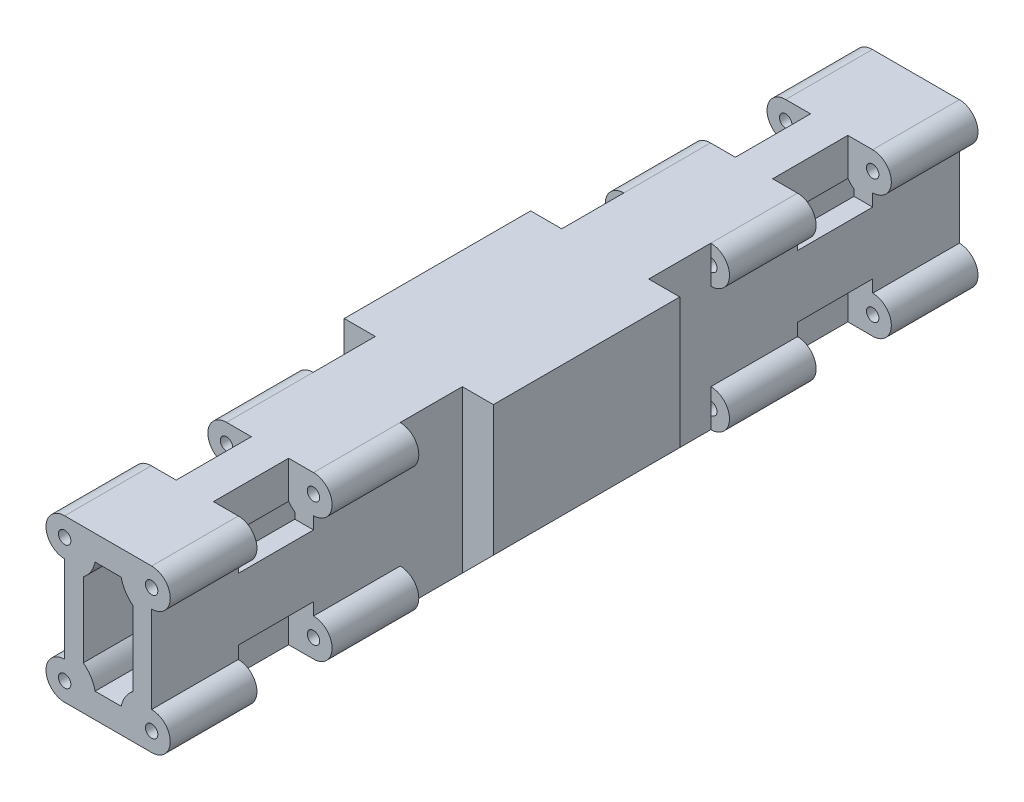
from build123d import *

# Parameters (mm, degrees)
SKETCH_1_W               = 24
SKETCH_1_H               = 26
EXTRUDE_1_DEPTH          = 65
SKETCH_7_W               = 5
SKETCH_7_H               = 26
CUT_EXTRUDE_5_DEPTH      = 50
SKETCH_4_R               = 3
EXTRUDE_3_DEPTH          = 40
SKETCH_5_W               = 12.1
SKETCH_5_H               = 8
CUT_EXTRUDE_3_DEPTH      = 4
SKETCH_6_R               = 1
CUT_EXTRUDE_4_DEPTH      = 40
MIRROR_2_COPY_1_SKETCH_W = 5
MIRROR_2_COPY_1_SKETCH_H = 26
MIRROR_2_COPY_1_DEPTH    = 50
MIRROR_2_COPY_2_SKETCH_R = 3
MIRROR_2_COPY_2_DEPTH    = 40
MIRROR_2_COPY_3_SKETCH_W = 12.1
MIRROR_2_COPY_3_SKETCH_H = 8
MIRROR_2_COPY_3_DEPTH    = 4
MIRROR_2_COPY_4_SKETCH_R = 1
MIRROR_2_COPY_4_DEPTH    = 40
CUT_EXTRUDE_7_DEPTH      = 68.420693576
CUT_EXTRUDE_7_DEPTH_BACK = 68.420693576
CUT_EXTRUDE_8_REACH      = 83.979


with BuildPart() as part:
    # Эскиз1 → Бобышка-Вытянуть1 (new, symmetric)
    with BuildSketch(Plane.XY):
        with Locations((0, -0.287208972)):
            Rectangle(SKETCH_1_W, SKETCH_1_H)
    extrude(amount=EXTRUDE_1_DEPTH, both=True)

    # Эскиз7 → Вырез-Вытянуть5 (cut)
    with BuildSketch(Plane.XY.offset(65)):
        with Locations((-9.5, -0.287208972)):
            Rectangle(SKETCH_7_W, SKETCH_7_H)
    cut_extrude_5 = extrude(amount=-CUT_EXTRUDE_5_DEPTH, mode=Mode.SUBTRACT)

    # Эскиз4 → Бобышка-Вытянуть3 (add)
    with BuildSketch(Plane.XY.offset(65)):
        with BuildLine():
            ThreePointArc((-4, -10.287208972), (-4.878679656, -8.165888628), (-7, -7.287208972))
            Line((-7, -7.287208972), (-7, -13.287208972))
            ThreePointArc((-7, -13.287208972), (-4.878679656, -12.408529315), (-4, -10.287208972))
        make_face()
        with BuildLine():
            Line((-7, -13.287208972), (-7, -7.287208972))
            ThreePointArc((-7, -7.287208972), (-10, -10.287208972), (-7, -13.287208972))
        make_face()
        with Locations((-7, 9.712791028)):
            Circle(SKETCH_4_R)
    extrude_3 = extrude(amount=-EXTRUDE_3_DEPTH)

    # Эскиз5 → Вырез-Вытянуть3 (cut, symmetric)
    with BuildSketch(Plane.ZY.offset(7)):
        with Locations((45, -9.287208972)):
            Rectangle(SKETCH_5_W, SKETCH_5_H)
        with Locations((45, 8.712791028)):
            Rectangle(SKETCH_5_W, SKETCH_5_H)
    cut_extrude_3 = extrude(amount=CUT_EXTRUDE_3_DEPTH, both=True, mode=Mode.SUBTRACT)

    # Эскиз6 → Вырез-Вытянуть4 (cut)
    with BuildSketch(Plane.XY.offset(65)):
        with Locations((-7, 9.712791028)):
            Circle(SKETCH_6_R)
        with Locations((-7, -10.287208972)):
            Circle(SKETCH_6_R)
    cut_extrude_4 = extrude(amount=-CUT_EXTRUDE_4_DEPTH, mode=Mode.SUBTRACT)

    # Зеркальное отражение1: Вырез-Вытянуть5, Бобышка-Вытянуть3, Вырез-Вытянуть3, Вырез-Вытянуть4 across plane
    add(cut_extrude_5.mirror(Plane.XY), mode=Mode.SUBTRACT)
    add(extrude_3.mirror(Plane.XY))
    add(cut_extrude_3.mirror(Plane.XY), mode=Mode.SUBTRACT)
    add(cut_extrude_4.mirror(Plane.XY), mode=Mode.SUBTRACT)

    # Зеркальное отражение2: Вырез-Вытянуть5, Бобышка-Вытянуть3, Вырез-Вытянуть3, Вырез-Вытянуть4 across plane
    add(cut_extrude_5.mirror(Plane(origin=(0, 0, 0), x_dir=(0, 0, 1), z_dir=(1, 0, 0))), mode=Mode.SUBTRACT)
    add(extrude_3.mirror(Plane(origin=(0, 0, 0), x_dir=(0, 0, 1), z_dir=(1, 0, 0))))
    add(cut_extrude_3.mirror(Plane(origin=(0, 0, 0), x_dir=(0, 0, 1), z_dir=(1, 0, 0))), mode=Mode.SUBTRACT)
    add(cut_extrude_4.mirror(Plane(origin=(0, 0, 0), x_dir=(0, 0, 1), z_dir=(1, 0, 0))), mode=Mode.SUBTRACT)

    # Зеркальное отражение2 copy 1 sketch → Зеркальное отражение2 copy 1 (cut)
    with BuildSketch(Plane(origin=(0, 0, -65), x_dir=(-1, 0, 0), z_dir=(0, 0, -1))):
        with Locations((-9.5, -0.287208972)):
            Rectangle(MIRROR_2_COPY_1_SKETCH_W, MIRROR_2_COPY_1_SKETCH_H)
    extrude(amount=-MIRROR_2_COPY_1_DEPTH, mode=Mode.SUBTRACT)

    # Зеркальное отражение2 copy 2 sketch → Зеркальное отражение2 copy 2 (add)
    with BuildSketch(Plane(origin=(0, 0, -65), x_dir=(-1, 0, 0), z_dir=(0, 0, -1))):
        with BuildLine():
            ThreePointArc((-4, -10.287208972), (-4.878679656, -8.165888628), (-7, -7.287208972))
            Line((-7, -7.287208972), (-7, -13.287208972))
            ThreePointArc((-7, -13.287208972), (-4.878679656, -12.408529315), (-4, -10.287208972))
        make_face()
        with BuildLine():
            Line((-7, -13.287208972), (-7, -7.287208972))
            ThreePointArc((-7, -7.287208972), (-10, -10.287208972), (-7, -13.287208972))
        make_face()
        with Locations((-7, 9.712791028)):
            Circle(MIRROR_2_COPY_2_SKETCH_R)
    extrude(amount=-MIRROR_2_COPY_2_DEPTH)

    # Зеркальное отражение2 copy 3 sketch → Зеркальное отражение2 copy 3 (cut, symmetric)
    with BuildSketch(Plane(origin=(7, 0, 0), x_dir=(0, 0, -1), z_dir=(1, 0, 0))):
        with Locations((45, -9.287208972)):
            Rectangle(MIRROR_2_COPY_3_SKETCH_W, MIRROR_2_COPY_3_SKETCH_H)
        with Locations((45, 8.712791028)):
            Rectangle(MIRROR_2_COPY_3_SKETCH_W, MIRROR_2_COPY_3_SKETCH_H)
    extrude(amount=MIRROR_2_COPY_3_DEPTH, both=True, mode=Mode.SUBTRACT)

    # Зеркальное отражение2 copy 4 sketch → Зеркальное отражение2 copy 4 (cut)
    with BuildSketch(Plane(origin=(0, 0, -65), x_dir=(-1, 0, 0), z_dir=(0, 0, -1))):
        with Locations((-7, 9.712791028)):
            Circle(MIRROR_2_COPY_4_SKETCH_R)
        with Locations((-7, -10.287208972)):
            Circle(MIRROR_2_COPY_4_SKETCH_R)
    extrude(amount=-MIRROR_2_COPY_4_DEPTH, mode=Mode.SUBTRACT)

    # Эскиз9 → Вырез-Вытянуть7 (cut, two sides: drawn at the far end of the back side and taken through both)
    with BuildSketch(Plane.XY.offset(-CUT_EXTRUDE_7_DEPTH_BACK)):
        with BuildLine():
            Line((0, -9.287208972), (0, 8.712791028))
            Line((0, 8.712791028), (-2.101020514, 8.712791028))
            ThreePointArc((-2.101020514, 8.712791028), (-2.775255129, 7.038556414), (-4, 5.712791028))
            Line((-4, 5.712791028), (-4, -6.287208972))
            ThreePointArc((-4, -6.287208972), (-2.775255129, -7.612974358), (-2.101020514, -9.287208972))
            Line((-2.101020514, -9.287208972), (0, -9.287208972))
        make_face()
        with BuildLine():
            Line((2.101020514, 8.712791028), (0, 8.712791028))
            Line((0, 8.712791028), (0, -9.287208972))
            Line((0, -9.287208972), (2.101020514, -9.287208972))
            ThreePointArc((2.101020514, -9.287208972), (2.775255129, -7.612974358), (4, -6.287208972))
            Line((4, -6.287208972), (4, 5.712791028))
            ThreePointArc((4, 5.712791028), (2.775255129, 7.038556414), (2.101020514, 8.712791028))
        make_face()
    extrude(amount=CUT_EXTRUDE_7_DEPTH + CUT_EXTRUDE_7_DEPTH_BACK, mode=Mode.SUBTRACT)

    # Эскиз10 → Вырез-Вытянуть8 (cut, up to next)
    with BuildSketch(Plane.XY.offset(15), mode=Mode.PRIVATE) as cut_extrude_8_sk1:
        Polygon((-7, -13.287208972), (-12, -8.287208972), (-12, -13.287208972), align=None)
    cut_extrude_8_tool1 = extrude(cut_extrude_8_sk1.sketch, amount=-CUT_EXTRUDE_8_REACH, mode=Mode.PRIVATE) & part.part
    # Эскиз10 → Вырез-Вытянуть8 (cut, up to next)
    with BuildSketch(Plane.XY.offset(15), mode=Mode.PRIVATE) as cut_extrude_8_sk2:
        Polygon((7, -13.287208972), (12, -13.287208972), (12, -8.287208972), align=None)
    cut_extrude_8_tool2 = extrude(cut_extrude_8_sk2.sketch, amount=-CUT_EXTRUDE_8_REACH, mode=Mode.PRIVATE) & part.part
    add(cut_extrude_8_tool1.solids().sort_by_distance((-10.333333, -11.620542, 15))[0], mode=Mode.SUBTRACT)
    add(cut_extrude_8_tool2.solids().sort_by_distance((10.333333, -11.620542, 15))[0], mode=Mode.SUBTRACT)


solid = part.part
